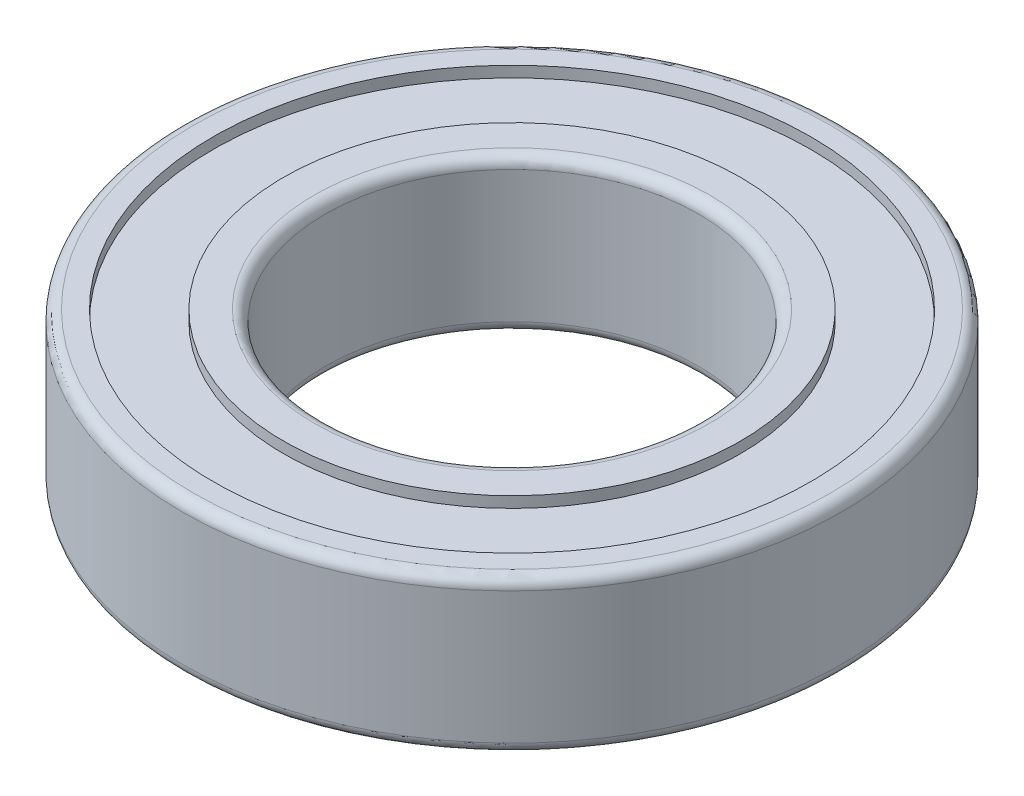
from build123d import *

# Parameters (mm, degrees)
VERRUNDUNG1_R = 0.5


with BuildPart() as part:
    # Skizze1 → Rotation1 (revolve)
    with BuildSketch(Plane.XY, mode=Mode.PRIVATE) as rotation1_sk:
        Polygon((8.5, 0), (10.4, 0), (10.4, 0.5), (13.6, 0.5), (13.6, 0), (15, 0), (15, 7), (13.6, 7), (13.6, 6.5), (10.4, 6.5), (10.4, 7), (8.5, 7), align=None)
    revolve(rotation1_sk.sketch.rotate(Axis((0, 0, 0), (0, 1, 0)), 90), axis=Axis((0, 0, 0), (0, 1, 0)))

    # Verrundung1
    verrundung1_edges = [part.edges().sort_by_distance(p)[0] for p in [
        (0, 7, 15),
        (0, 0, 15),
        (0, 0, 8.5),
        (0, 7, 8.5),
    ]]
    fillet(verrundung1_edges, radius=VERRUNDUNG1_R)


solid = part.part
